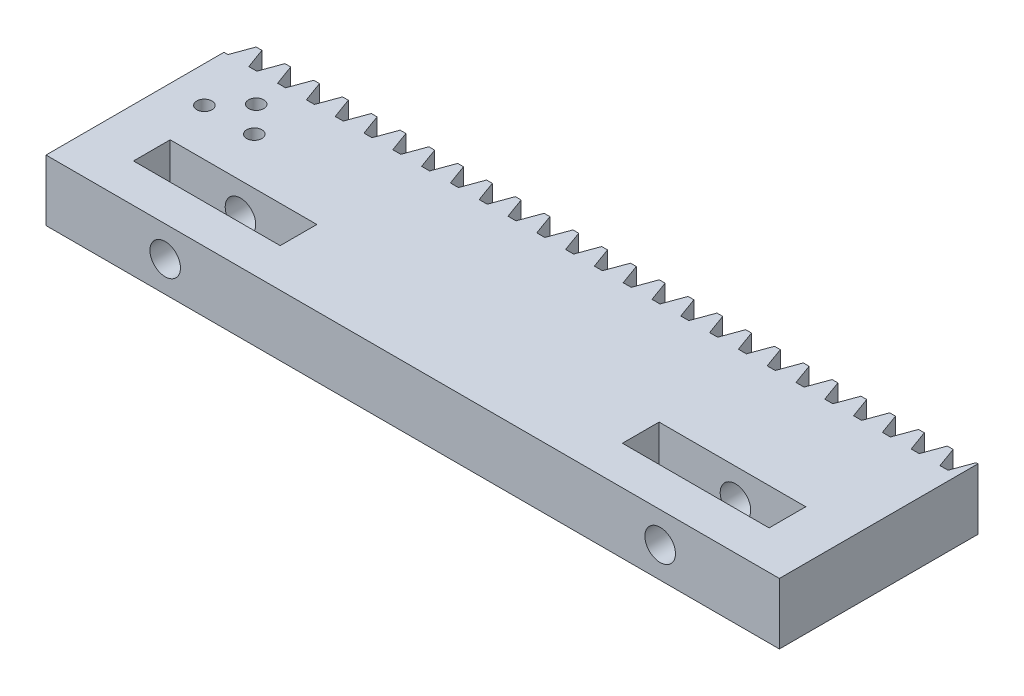
from build123d import *

# Parameters (mm, degrees)
BOSS_EXTRUDE1_DEPTH = 5
SKETCH3_W           = 120
SKETCH3_H           = 6
BOSS_EXTRUDE2_DEPTH = 10
SKETCH5_W           = 24
SKETCH5_H           = 6
CUT_EXTRUDE1_DEPTH  = 10
CUT_EXTRUDE2_START  = -5
SKETCH7_R           = 2.5
CUT_EXTRUDE2_DEPTH  = 25
SKETCH8_R           = 1.25
CUT_EXTRUDE3_DEPTH  = 20
SKETCH9_R           = 1.25
CUT_EXTRUDE4_DEPTH  = 10


with BuildPart() as part:
    # Sketch1 → Boss-Extrude1 (new, symmetric)
    with BuildSketch(Plane(origin=(0, 0, 0), x_dir=(1, 0, 0), z_dir=(0, 1, 0))):
        Polygon((58.46437743, 9.875), (57.15507132, 9.875), (55.92667178, 13.25), (54.980387995, 13.25), (53.751988455, 9.875), (52.442682345, 9.875), (51.214282805, 13.25), (50.26799902, 13.25), (49.03959948, 9.875), (47.73029337, 9.875), (46.50189383, 13.25), (45.555610045, 13.25), (44.327210505, 9.875), (43.017904395, 9.875), (41.789504855, 13.25), (40.84322107, 13.25), (39.61482153, 9.875), (38.30551542, 9.875), (37.07711588, 13.25), (36.130832095, 13.25), (34.902432555, 9.875), (33.593126445, 9.875), (32.364726905, 13.25), (31.41844312, 13.25), (30.19004358, 9.875), (28.88073747, 9.875), (27.65233793, 13.25), (26.706054145, 13.25), (25.477654605, 9.875), (24.168348495, 9.875), (22.939948955, 13.25), (21.99366517, 13.25), (20.76526563, 9.875), (19.45595952, 9.875), (18.22755998, 13.25), (17.281276195, 13.25), (16.052876655, 9.875), (14.743570545, 9.875), (13.515171005, 13.25), (12.56888722, 13.25), (11.34048768, 9.875), (10.03118157, 9.875), (8.80278203, 13.25), (7.856498245, 13.25), (6.628098705, 9.875), (5.318792595, 9.875), (4.090393055, 13.25), (3.14410927, 13.25), (1.91570973, 9.875), (0.60640362, 9.875), (-0.62199592, 13.25), (-1.568279705, 13.25), (-2.796679245, 9.875), (-4.105985355, 9.875), (-5.334384895, 13.25), (-6.28066868, 13.25), (-7.50906822, 9.875), (-8.81837433, 9.875), (-10.04677387, 13.25), (-10.993057655, 13.25), (-12.221457195, 9.875), (-13.530763305, 9.875), (-14.759162845, 13.25), (-15.70544663, 13.25), (-16.93384617, 9.875), (-18.24315228, 9.875), (-19.47155182, 13.25), (-20.417835605, 13.25), (-21.646235145, 9.875), (-22.955541255, 9.875), (-24.183940795, 13.25), (-25.13022458, 13.25), (-26.35862412, 9.875), (-27.66793023, 9.875), (-28.89632977, 13.25), (-29.842613555, 13.25), (-31.071013095, 9.875), (-32.380319205, 9.875), (-33.608718745, 13.25), (-34.55500253, 13.25), (-35.78340207, 9.875), (-37.09270818, 9.875), (-38.32110772, 13.25), (-39.267391505, 13.25), (-40.495791045, 9.875), (-41.805097155, 9.875), (-43.033496695, 13.25), (-43.97978048, 13.25), (-45.20818002, 9.875), (-46.51748613, 9.875), (-47.74588567, 13.25), (-48.692169455, 13.25), (-49.920568995, 9.875), (-51.229875105, 9.875), (-52.458274645, 13.25), (-53.40455843, 13.25), (-54.63295797, 9.875), (-55.94226408, 9.875), (-57.17066362, 13.25), (-58.116947405, 13.25), (-59.345346945, 9.875), (-60, 9.875), (-60, -13.25), (60, -13.25), (60, 13.25), (59.69277697, 13.25), align=None)
    extrude(amount=BOSS_EXTRUDE1_DEPTH, both=True)

    # Sketch3 → Boss-Extrude2 (add)
    with BuildSketch(Plane(origin=(0, 5, 0), x_dir=(1, 0, 0), z_dir=(0, 1, 0))):
        with Locations((0, -16.25)):
            Rectangle(SKETCH3_W, SKETCH3_H)
    extrude(amount=-BOSS_EXTRUDE2_DEPTH)

    # Sketch5 → Cut-Extrude1 (cut)
    with BuildSketch(Plane(origin=(0, 5, 0), x_dir=(1, 0, 0), z_dir=(0, 1, 0))):
        with Locations((-40, -9.932851702)):
            Rectangle(SKETCH5_W, SKETCH5_H)
        with Locations((40, -9.932851702)):
            Rectangle(SKETCH5_W, SKETCH5_H)
    extrude(amount=-CUT_EXTRUDE1_DEPTH, mode=Mode.SUBTRACT)

    # Sketch7 → Cut-Extrude2 (cut)
    with BuildSketch(Plane.XY.offset(6.932851702).offset(CUT_EXTRUDE2_START)):
        with Locations((-40.495791045, 0)):
            Circle(SKETCH7_R)
    cut_extrude2 = extrude(amount=CUT_EXTRUDE2_DEPTH, mode=Mode.SUBTRACT)

    # Mirror1: Cut-Extrude2 across plane
    add(cut_extrude2.mirror(Plane(origin=(0, 0, 0), x_dir=(0, 0, 1), z_dir=(1, 0, 0))), mode=Mode.SUBTRACT)

    # Sketch8 → Cut-Extrude3 (cut)
    with BuildSketch(Plane(origin=(0, 5, 0), x_dir=(1, 0, 0), z_dir=(0, 1, 0))):
        with Locations(Location((-54.081860638, 0.75, 0), (0, 0, 270))):
            Circle(SKETCH8_R)
        with Locations(Location((-45.918139363, 0.75, 0), (0, 0, 270))):
            Circle(SKETCH8_R)
    extrude(amount=-CUT_EXTRUDE3_DEPTH, mode=Mode.SUBTRACT)

    # Sketch9 → Cut-Extrude4 (cut)
    with BuildSketch(Plane(origin=(0, 5, 0), x_dir=(1, 0, 0), z_dir=(0, 1, 0))):
        with Locations(Location((-50, 5.147546331, 0), (0, 0, 270))):
            Circle(SKETCH9_R)
    extrude(amount=-CUT_EXTRUDE4_DEPTH, mode=Mode.SUBTRACT)


solid = part.part
